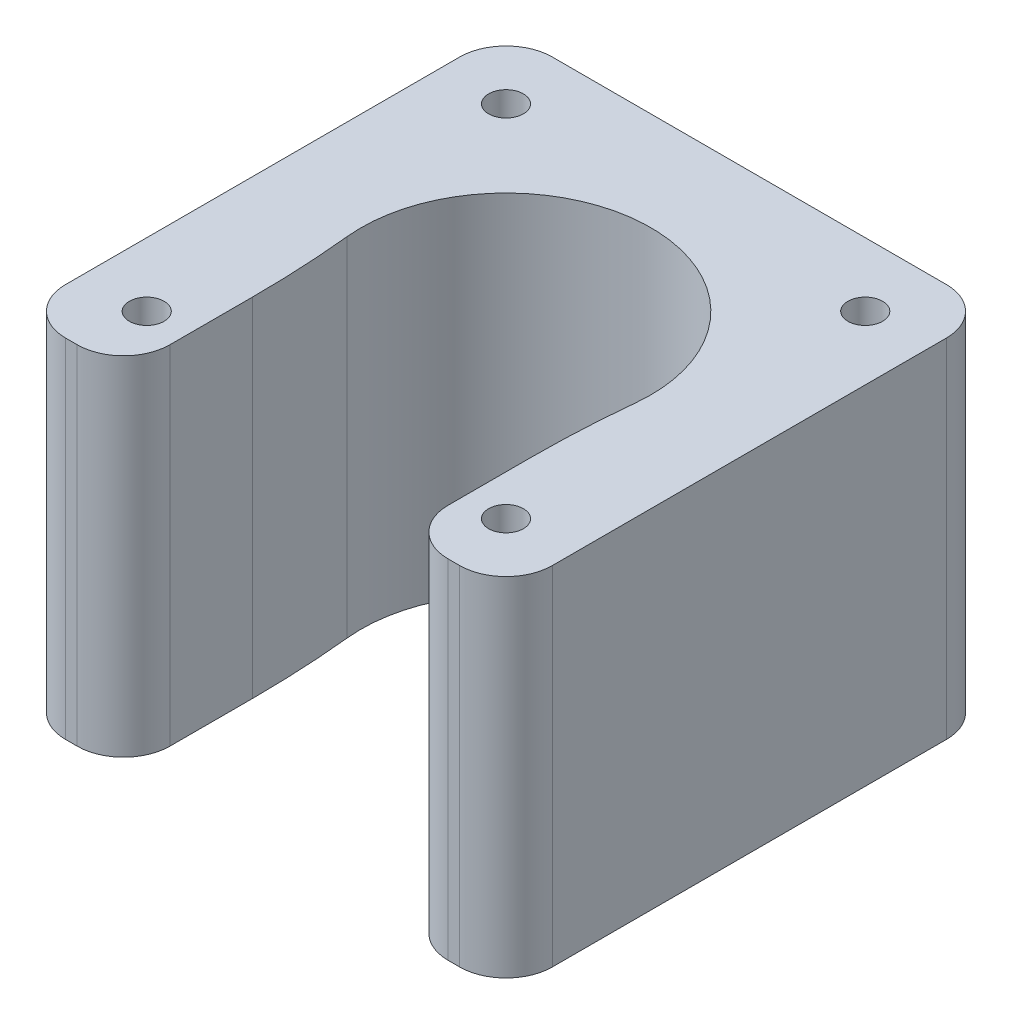
from build123d import *

# Parameters (mm, degrees)
BOSS_EXTRUDE1_DEPTH = 30
FILLET1_R           = 85
FILLET2_R           = 4


with BuildPart() as part:
    # Sketch1 → Boss-Extrude1 (new body)
    with BuildSketch(Plane(origin=(0, 0, 0), x_dir=(1, 0, 0), z_dir=(0, 1, 0))):
        with BuildLine():
            Line((-12, -21), (-12, -15.5))
            Line((-12, -15.5), (-14, -15.5))
            ThreePointArc((-14, -15.5), (-16.560660172, -16.560660172), (-15.5, -14))
            Line((-15.5, -14), (-15.5, 14))
            ThreePointArc((-15.5, 14), (-16.560660172, 16.560660172), (-14, 15.5))
            Line((-14, 15.5), (14, 15.5))
            ThreePointArc((14, 15.5), (15.5, 17), (17, 15.5))
            ThreePointArc((17, 15.5), (16.560660172, 14.439339828), (15.5, 14))
            Line((15.5, 14), (15.5, -14))
            ThreePointArc((15.5, -14), (16.560660172, -14.439339828), (17, -15.5))
            ThreePointArc((17, -15.5), (15.5, -17), (14, -15.5))
            Line((14, -15.5), (12, -15.5))
            Line((12, -15.5), (12, -21))
            Line((12, -21), (21, -21))
            Line((21, -21), (21, 21))
            Line((21, 21), (-21, 21))
            Line((-21, 21), (-21, -21))
            Line((-21, -21), (-12, -21))
        make_face()
        with BuildLine():
            Line((-12, -15.5), (-12, -3.5))
            ThreePointArc((-12, -3.5), (-1.767766953, 12.374368671), (12.5, 0))
            ThreePointArc((12.5, 0), (12.374368671, -1.767766953), (12, -3.5))
            Line((12, -3.5), (12, -15.5))
            Line((12, -15.5), (14, -15.5))
            ThreePointArc((14, -15.5), (14.439339828, -14.439339828), (15.5, -14))
            Line((15.5, -14), (15.5, 14))
            ThreePointArc((15.5, 14), (14.439339828, 14.439339828), (14, 15.5))
            Line((14, 15.5), (-14, 15.5))
            ThreePointArc((-14, 15.5), (-14.439339828, 14.439339828), (-15.5, 14))
            Line((-15.5, 14), (-15.5, -14))
            ThreePointArc((-15.5, -14), (-14.439339828, -14.439339828), (-14, -15.5))
            Line((-14, -15.5), (-12, -15.5))
        make_face()
    extrude(amount=BOSS_EXTRUDE1_DEPTH)

    # Fillet1
    fillet1_edges = [part.edges().sort_by_distance(p)[0] for p in [
        (-12, 15, 3.5),
        (12, 15, 3.5),
    ]]
    fillet(fillet1_edges, radius=FILLET1_R)

    # Fillet2
    fillet2_edges = [part.edges().sort_by_distance(p)[0] for p in [
        (-12, 15, 21),
        (-21, 15, 21),
        (-21, 15, -21),
        (21, 15, -21),
        (21, 15, 21),
        (12, 15, 21),
    ]]
    fillet(fillet2_edges, radius=FILLET2_R)


solid = part.part
